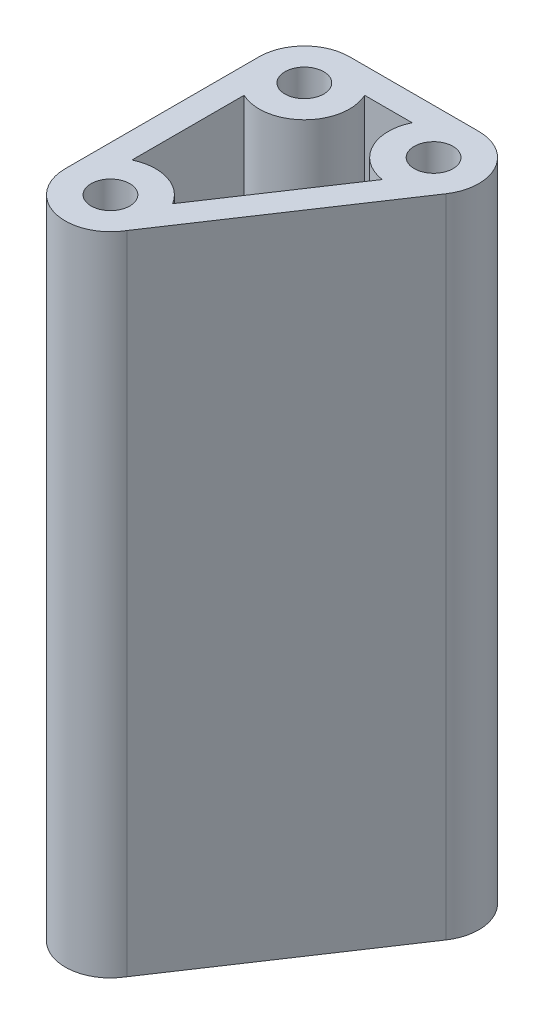
from build123d import *
from build123d.topology import SkipClean

# Parameters (mm, degrees)
SKETCH1_R           = 1.5
BOSS_EXTRUDE1_DEPTH = 50
SHELL2_T            = -2
CUT_EXTRUDE1_DEPTH  = 54.219702176


with BuildPart() as part:
    # Sketch1 → Boss-Extrude1 (new body)
    with BuildSketch(Plane(origin=(0, 0, 0), x_dir=(1, 0, 0), z_dir=(0, 1, 0))):
        with BuildLine():
            Line((-11.236028054, 16.552141364), (-11.236028054, 1.552141364))
            ThreePointArc((-11.236028054, 1.552141364), (-8.641894712, -1.828599028), (-4.704939141, -0.197858636))
            Line((-4.704939141, -0.197858636), (5.169075286, 14.600123285))
            ThreePointArc((5.169075286, 14.600123285), (5.352827986, 18.19803576), (2.263971946, 20.052141364))
            Line((2.263971946, 20.052141364), (-7.736028054, 20.052141364))
            ThreePointArc((-7.736028054, 20.052141364), (-10.210901788, 19.027015098), (-11.236028054, 16.552141364))
        make_face()
        with Locations(Location((-7.736028054, 16.552141364, 0), (0, 0, 270))):
            Circle(SKETCH1_R, mode=Mode.SUBTRACT)
        with Locations(Location((2.263971946, 16.552141364, 0), (0, 0, 270))):
            Circle(SKETCH1_R, mode=Mode.SUBTRACT)
        with Locations(Location((-7.736028054, 1.552141364, 0), (0, 0, 270))):
            Circle(SKETCH1_R, mode=Mode.SUBTRACT)
    extrude(amount=BOSS_EXTRUDE1_DEPTH)

    # Shell2
    shell2_openings = [part.faces().sort_by_distance(p)[0] for p in [
        (-4.434629852, 50, -10.910758817),
    ]]
    offset(amount=SHELL2_T, openings=shell2_openings)

    # Sketch2 → Cut-Extrude1 (cut, through all)
    with SkipClean():  # the faces are left unmerged after this step: merging them gives an invalid solid
        with BuildSketch(Plane(origin=(0, 2, 0), x_dir=(1, 0, 0), z_dir=(0, 1, 0))):
            with BuildLine():
                Line((-9.236028054, 13.389863704), (-9.236028054, 4.714419024))
                ThreePointArc((-9.236028054, 4.714419024), (-6.72499281, 4.90293347), (-4.737288861, 3.357013451))
                Line((-4.737288861, 3.357013451), (1.75650333, 13.089125972))
                ThreePointArc((1.75650333, 13.089125972), (-0.822229583, 14.901274888), (-0.898305714, 18.052141364))
                Line((-0.898305714, 18.052141364), (-4.573750394, 18.052141364))
                ThreePointArc((-4.573750394, 18.052141364), (-5.26115432, 14.07726763), (-9.236028054, 13.389863704))
            make_face()
        extrude(amount=-CUT_EXTRUDE1_DEPTH, mode=Mode.SUBTRACT)


solid = part.part
